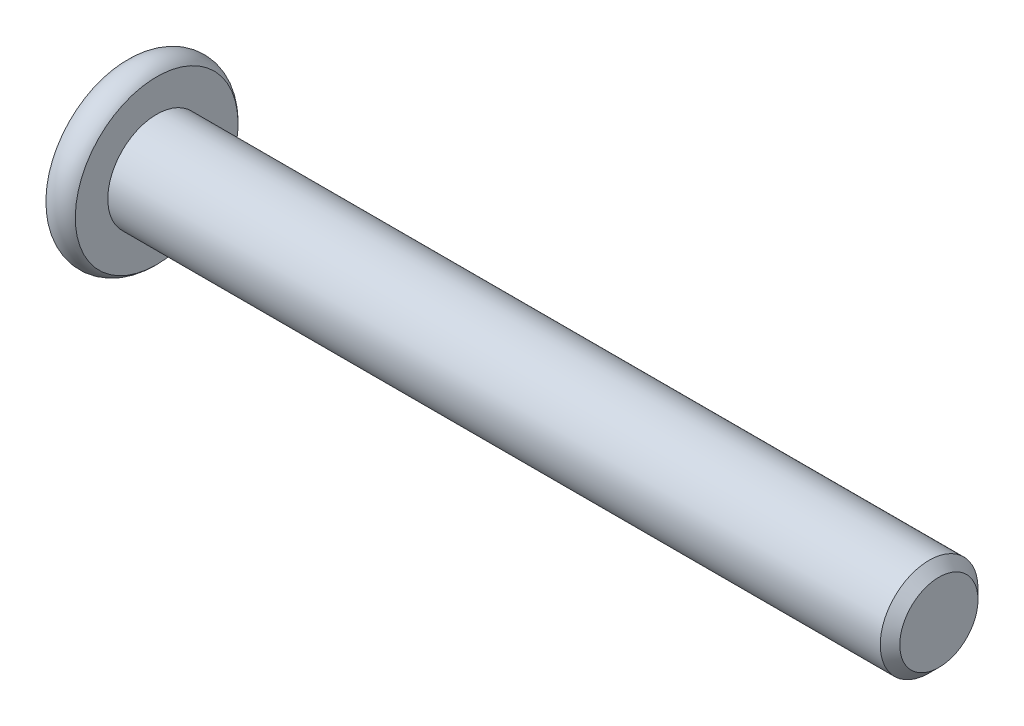
from build123d import *

# Parameters (mm, degrees)
SKETCH2_R           = 2.5
BOSS_EXTRUDE1_DEPTH = 40
CHAMFER1_SIZE       = 0.5
CUT_EXTRUDE1_DEPTH  = 2.3
SKETCH8_R           = 1.782050808
CUT_EXTRUDE2_DEPTH  = 1
CUT_EXTRUDE2_DRAFT  = -45


with BuildPart() as part:
    # Sketch2 → Boss-Extrude1 (new body)
    with BuildSketch(Plane(origin=(0, 0, 0), x_dir=(0, 0, -1), z_dir=(1, 0, 0))):
        Circle(SKETCH2_R)
    extrude(amount=-BOSS_EXTRUDE1_DEPTH)

    # Chamfer1
    chamfer1_edges = [part.edges().sort_by_distance(p)[0] for p in [
        (0, 0, 2.5),
    ]]
    chamfer(chamfer1_edges, length=CHAMFER1_SIZE)

    # Sketch6 → Revolve1 (revolve)
    with BuildSketch(Plane.XY, mode=Mode.PRIVATE) as revolve1_sk:
        with BuildLine():
            Line((-41.5, 0), (-41.5, 4.161437828))
            ThreePointArc((-41.5, 4.161437828), (-40.75, 4.5), (-40, 4.161437828))
            Line((-40, 4.161437828), (-40, 0))
            Line((-40, 0), (-41.5, 0))
        make_face()
    revolve(revolve1_sk.sketch.rotate(Axis((-40, 0, 0), (1, 0, 0)), 180), axis=Axis((-40, 0, 0), (1, 0, 0)))

    # Sketch7 → Cut-Extrude1 (cut)
    with BuildSketch(Plane.ZY.offset(41.5)):
        Polygon((0, 1.732050808), (-1.5, 0.866025404), (-1.5, -0.866025404), (0, -1.732050808), (1.5, -0.866025404), (1.5, 0.866025404), align=None)
    extrude(amount=-CUT_EXTRUDE1_DEPTH, mode=Mode.SUBTRACT)


with BuildPart() as cut_extrude2_tool:
    # Sketch8 → Cut-Extrude2 (with draft: the straight prism first)
    with BuildSketch(Plane.ZY.offset(41.5)):
        Circle(SKETCH8_R)
    extrude(amount=-CUT_EXTRUDE2_DEPTH)
    # Cut-Extrude2: the draft: its side faces are tilted about the plane it starts from
    cut_extrude2_sides = [cut_extrude2_tool.faces().sort_by_distance(p)[0] for p in [
        (-41, 0, -1.782050808),
    ]]
    draft(cut_extrude2_sides, Plane.ZY.offset(41.5), CUT_EXTRUDE2_DRAFT)


with BuildPart() as part_1:
    add(part.part)

    # Cut-Extrude2: cut by cut_extrude2_tool
    add(cut_extrude2_tool.part, mode=Mode.SUBTRACT)


solid = part_1.part
